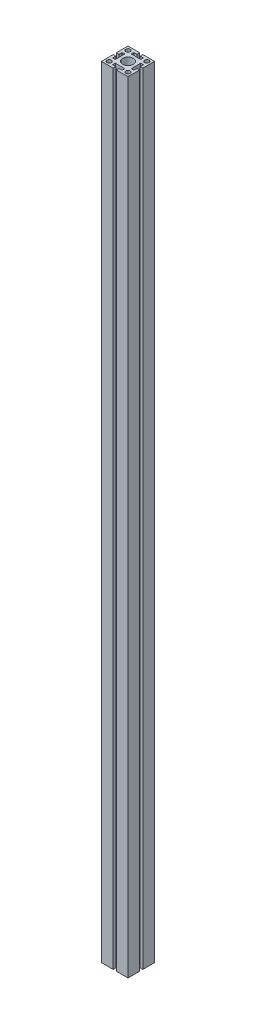
from build123d import *

# Parameters (mm, degrees)
SKETCH1_R           = 10
SKETCH1_R_2         = 4.138691164
BOSS_EXTRUDE1_DEPTH = 1470


with BuildPart() as part:
    # Sketch1 → Boss-Extrude1 (new body)
    with BuildSketch(Plane(origin=(0, 0, 0), x_dir=(1, 0, 0), z_dir=(0, 1, 0))):
        Polygon((-25, -3), (-25, -25), (-3, -25), (-3, -20), (-9, -20), (-9, -15), (9, -15), (9, -20), (3, -20), (3, -25), (25, -25), (25, -3), (20, -3), (20, -9), (15, -9), (15, 9), (20, 9), (20, 3), (25, 3), (25, 25), (3, 25), (3, 20), (9, 20), (9, 15), (-9, 15), (-9, 20), (-3, 20), (-3, 25), (-25, 25), (-25, 3), (-20, 3), (-20, 9), (-15, 9), (-15, -9), (-20, -9), (-20, -3), align=None)
        with Locations(Location((0, 0, 0), (0, 0, 270))):
            Circle(SKETCH1_R, mode=Mode.SUBTRACT)
        with Locations(Location((-17.67766953, 17.67766953, 0), (0, 0, 270))):
            Circle(SKETCH1_R_2, mode=Mode.SUBTRACT)
        with Locations(Location((17.67766953, 17.67766953, 0), (0, 0, 270))):
            Circle(SKETCH1_R_2, mode=Mode.SUBTRACT)
        with Locations(Location((17.67766953, -17.67766953, 0), (0, 0, 270))):
            Circle(SKETCH1_R_2, mode=Mode.SUBTRACT)
        with Locations(Location((-17.67766953, -17.67766953, 0), (0, 0, 270))):
            Circle(SKETCH1_R_2, mode=Mode.SUBTRACT)
    extrude(amount=BOSS_EXTRUDE1_DEPTH)


solid = part.part
